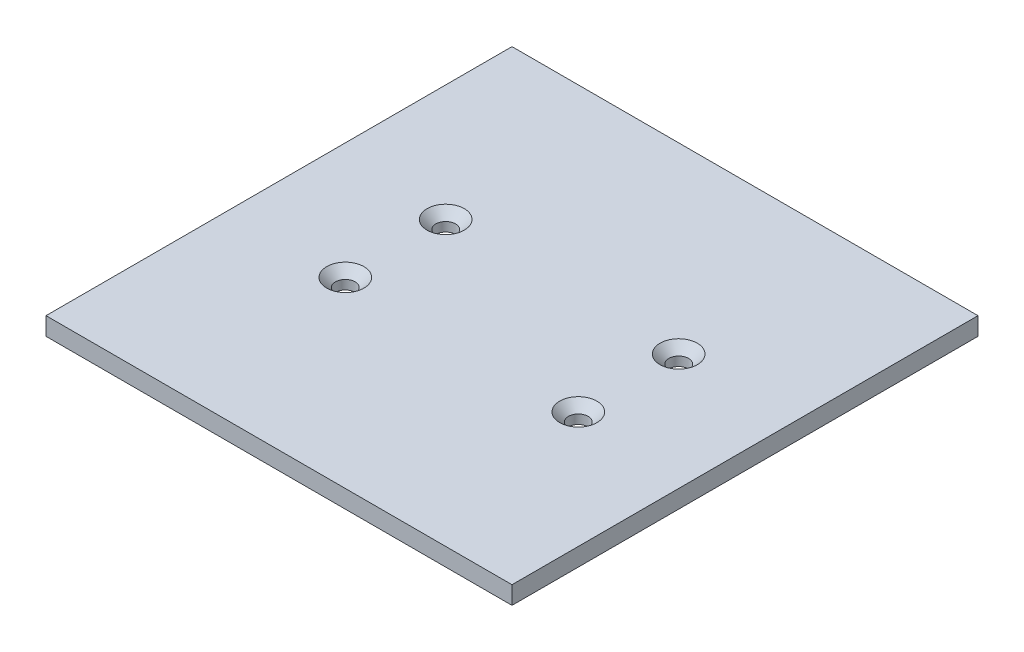
from build123d import *

# Parameters (mm, degrees)
SCHIZZO1_W                            = 130
SCHIZZO1_H                            = 130
ESTRUSIONE_ESTRUSIONE1_DEPTH          = 5
FORO_SVASATO_PER_VITE_M5_1_AT_2_COUNT = 2
FORO_SVASATO_PER_VITE_M5_1_AT_2_PITCH = 65
FORO_SVASATO_PER_VITE_M5_1_AT_3_COUNT = 2
FORO_SVASATO_PER_VITE_M5_1_AT_3_PITCH = 70.774289117
FORO_SVASATO_PER_VITE_M5_1_AT_4_COUNT = 2
FORO_SVASATO_PER_VITE_M5_1_AT_4_PITCH = 28


with BuildPart() as part:
    # Schizzo1 → Estrusione-Estrusione1 (new body)
    with BuildSketch(Plane(origin=(0, 0, 0), x_dir=(1, 0, 0), z_dir=(0, 1, 0))):
        Rectangle(SCHIZZO1_W, SCHIZZO1_H)
    extrude(amount=ESTRUSIONE_ESTRUSIONE1_DEPTH)

    # Schizzo4 → Foro svasato per Vite M5-1 (revolve, cut)
    with BuildSketch(Plane(origin=(-32.5, 5, -14), x_dir=(0, 0, 1), z_dir=(1, 0, 0))):
        Polygon((0, 0), (0, 5), (2.75, 5), (2.75, 2.45), (5.2, 0), align=None)
    foro_svasato_per_vite_m5_1 = revolve(axis=Axis((-32.5, 11.35, -14), (0, -1, 0)), mode=Mode.SUBTRACT)

    # Foro svasato per Vite M5-1 at 2: Foro svasato per Vite M5-1 ×2
    with Locations(*[(i * FORO_SVASATO_PER_VITE_M5_1_AT_2_PITCH, 0, 0) for i in range(1, FORO_SVASATO_PER_VITE_M5_1_AT_2_COUNT)]):
        add(foro_svasato_per_vite_m5_1, mode=Mode.SUBTRACT)

    # Foro svasato per Vite M5-1 at 3: Foro svasato per Vite M5-1 ×2
    with Locations(*[Vector(0.9184126158110061, 0, 0.39562389604166415) * (i * FORO_SVASATO_PER_VITE_M5_1_AT_3_PITCH) for i in range(1, FORO_SVASATO_PER_VITE_M5_1_AT_3_COUNT)]):
        add(foro_svasato_per_vite_m5_1, mode=Mode.SUBTRACT)

    # Foro svasato per Vite M5-1 at 4: Foro svasato per Vite M5-1 ×2
    with Locations(*[(0, 0, i * FORO_SVASATO_PER_VITE_M5_1_AT_4_PITCH) for i in range(1, FORO_SVASATO_PER_VITE_M5_1_AT_4_COUNT)]):
        add(foro_svasato_per_vite_m5_1, mode=Mode.SUBTRACT)


solid = part.part
